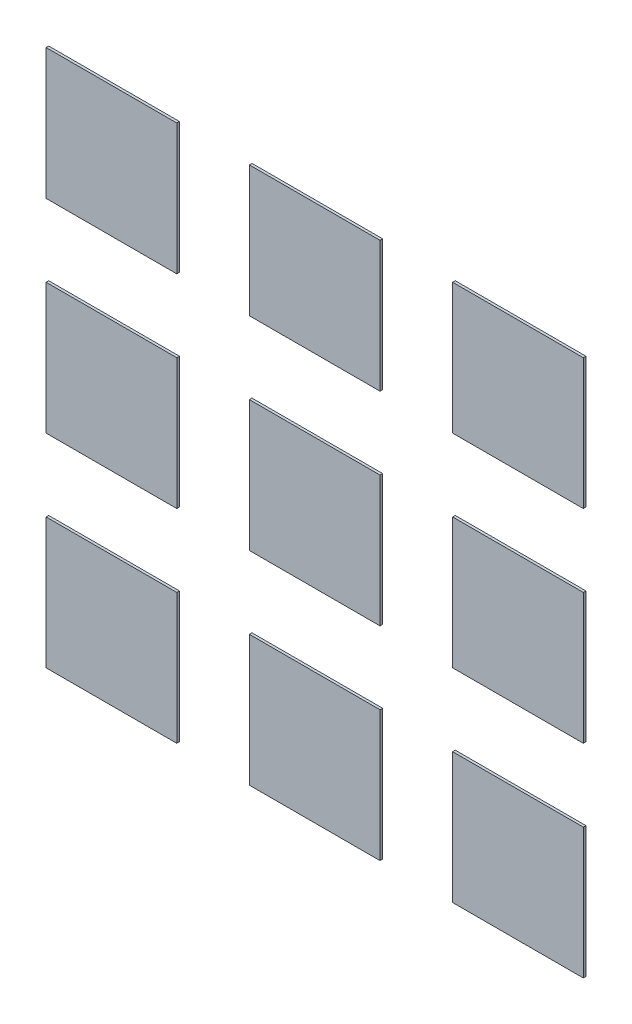
from build123d import *

# Parameters (mm, degrees)
SKICA1_W                  = 0.9
SKICA1_H                  = 0.9
P_IDAT_VYSUNUT_M1_DEPTH   = 0.018
P_IDAT_VYSUNUT_M1_2_DEPTH = 0.018
P_IDAT_VYSUNUT_M1_3_DEPTH = 0.018
P_IDAT_VYSUNUT_M1_4_DEPTH = 0.018
P_IDAT_VYSUNUT_M1_5_DEPTH = 0.018
P_IDAT_VYSUNUT_M1_6_DEPTH = 0.018
P_IDAT_VYSUNUT_M1_7_DEPTH = 0.018
P_IDAT_VYSUNUT_M1_8_DEPTH = 0.018
P_IDAT_VYSUNUT_M1_9_DEPTH = 0.018


with BuildPart() as part:
    # Skica1 → Přidat vysunutím1 (new body)
    with BuildSketch(Plane.XY):
        with Locations((-1.4, 1.4)):
            Rectangle(SKICA1_W, SKICA1_H)
    extrude(amount=P_IDAT_VYSUNUT_M1_DEPTH)


with BuildPart() as body_2:
    # Skica1 → P_idat vysunut_m1 2 (new body)
    with BuildSketch(Plane.XY):
        with Locations((1.4, -1.4)):
            Rectangle(SKICA1_W, SKICA1_H)
    extrude(amount=P_IDAT_VYSUNUT_M1_2_DEPTH)


with BuildPart() as body_3:
    # Skica1 → P_idat vysunut_m1 3 (new body)
    with BuildSketch(Plane.XY):
        with Locations((1.4, 1.4)):
            Rectangle(SKICA1_W, SKICA1_H)
    extrude(amount=P_IDAT_VYSUNUT_M1_3_DEPTH)


with BuildPart() as body_4:
    # Skica1 → P_idat vysunut_m1 4 (new body)
    with BuildSketch(Plane.XY):
        with Locations((-1.4, -1.4)):
            Rectangle(SKICA1_W, SKICA1_H)
    extrude(amount=P_IDAT_VYSUNUT_M1_4_DEPTH)


with BuildPart() as body_5:
    # Skica1 → P_idat vysunut_m1 5 (new body)
    with BuildSketch(Plane.XY):
        with Locations((0, 1.4)):
            Rectangle(SKICA1_W, SKICA1_H)
    extrude(amount=P_IDAT_VYSUNUT_M1_5_DEPTH)


with BuildPart() as body_6:
    # Skica1 → P_idat vysunut_m1 6 (new body)
    with BuildSketch(Plane.XY):
        with Locations((-1.4, 0)):
            Rectangle(SKICA1_W, SKICA1_H)
    extrude(amount=P_IDAT_VYSUNUT_M1_6_DEPTH)


with BuildPart() as body_7:
    # Skica1 → P_idat vysunut_m1 7 (new body)
    with BuildSketch(Plane.XY):
        with Locations((1.4, 0)):
            Rectangle(SKICA1_W, SKICA1_H)
    extrude(amount=P_IDAT_VYSUNUT_M1_7_DEPTH)


with BuildPart() as body_8:
    # Skica1 → P_idat vysunut_m1 8 (new body)
    with BuildSketch(Plane.XY):
        Rectangle(SKICA1_W, SKICA1_H)
    extrude(amount=P_IDAT_VYSUNUT_M1_8_DEPTH)


with BuildPart() as body_9:
    # Skica1 → P_idat vysunut_m1 9 (new body)
    with BuildSketch(Plane.XY):
        with Locations((0, -1.4)):
            Rectangle(SKICA1_W, SKICA1_H)
    extrude(amount=P_IDAT_VYSUNUT_M1_9_DEPTH)


solid = Compound([part.part, body_2.part, body_3.part, body_4.part, body_5.part, body_6.part, body_7.part, body_8.part, body_9.part])
